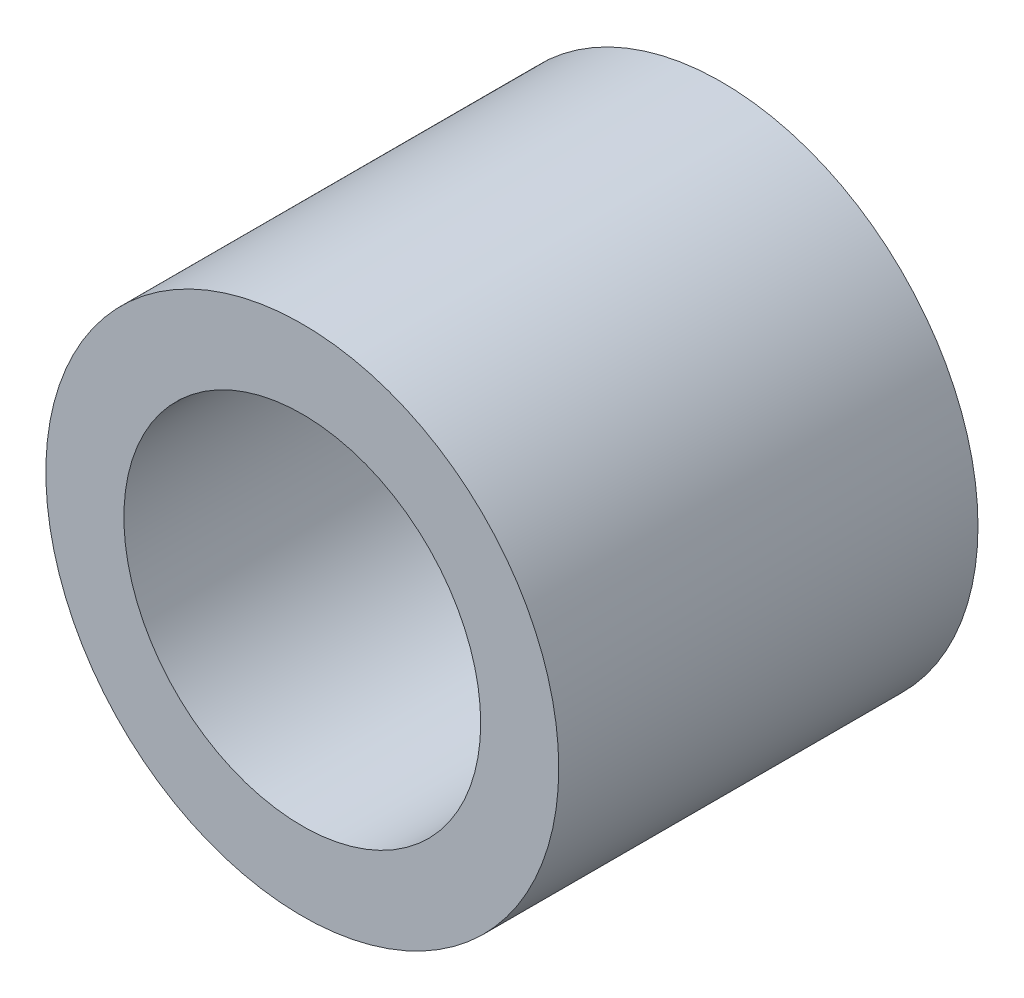
from build123d import *

# Parameters (mm, degrees)
SKETCH1_R           = 2.875
SKETCH1_R_2         = 2
BOSS_EXTRUDE1_DEPTH = 4.7


with BuildPart() as part:
    # Sketch1 → Boss-Extrude1 (new body)
    with BuildSketch(Plane.XY):
        Circle(SKETCH1_R)
        Circle(SKETCH1_R_2, mode=Mode.SUBTRACT)
    extrude(amount=BOSS_EXTRUDE1_DEPTH)


solid = part.part
